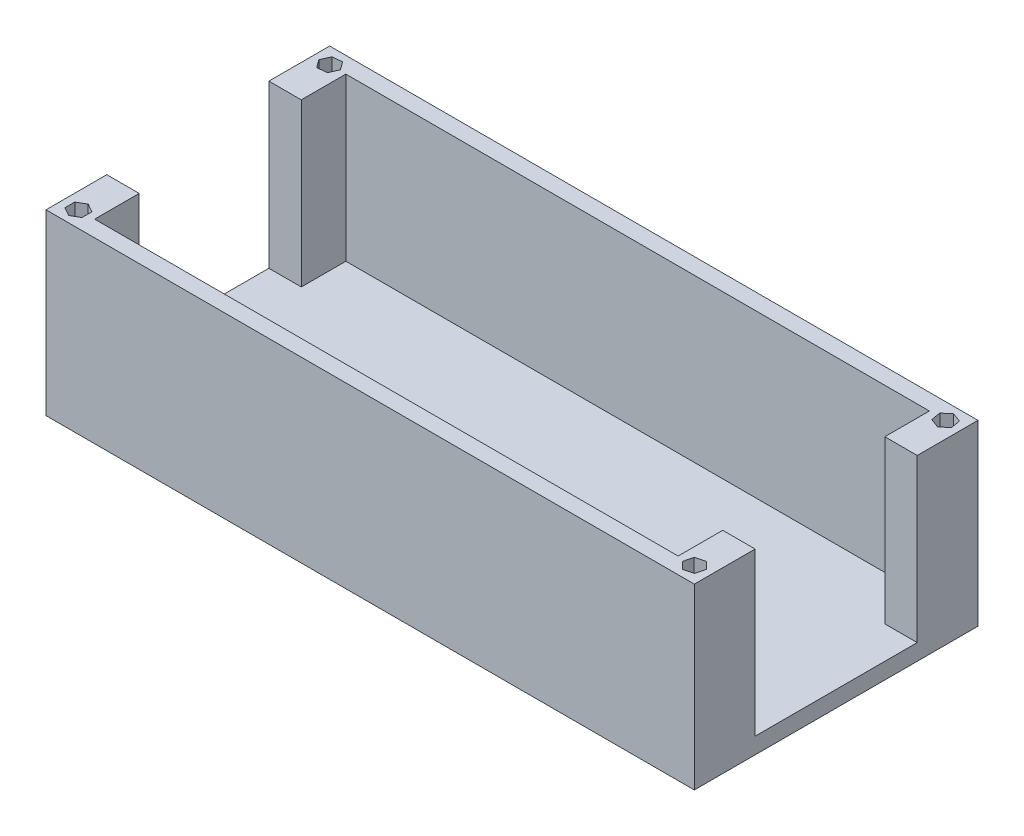
from build123d import *

# Parameters (mm, degrees)
SKETCH1_W           = 80
SKETCH1_H           = 35
BOSS_EXTRUDE1_DEPTH = 2
BOSS_EXTRUDE2_DEPTH = 20
CUT_EXTRUDE1_DEPTH  = 2.3


with BuildPart() as part:
    # Sketch1 → Boss-Extrude1 (new body)
    with BuildSketch(Plane(origin=(0, 0, 0), x_dir=(1, 0, 0), z_dir=(0, 1, 0))):
        with Locations((40, -17.5)):
            Rectangle(SKETCH1_W, SKETCH1_H)
    extrude(amount=BOSS_EXTRUDE1_DEPTH)

    # Sketch2 → Boss-Extrude2 (add)
    with BuildSketch(Plane(origin=(0, 2, 0), x_dir=(1, 0, 0), z_dir=(0, 1, 0))):
        Polygon((0, 0), (80, 0), (80, -7.5), (76, -7.5), (76, -2), (4, -2), (4, -7.5), (0, -7.5), align=None)
        Polygon((0, -35), (80, -35), (80, -27.5), (76, -27.5), (76, -33), (4, -33), (4, -27.5), (0, -27.5), align=None)
    extrude(amount=BOSS_EXTRUDE2_DEPTH)

    # Sketch3 → Cut-Extrude1 (cut)
    with BuildSketch(Plane(origin=(0, 22, 0), x_dir=(1, 0, 0), z_dir=(0, 1, 0))):
        Polygon((2.490559859, -0.891238969), (1.285064709, -1.020782184), (0.794504851, -2.129543216), (1.509440141, -3.108761031), (2.714935291, -2.979217816), (3.205495149, -1.870456784), align=None)
        Polygon((2, -31.787564435), (0.95, -32.393782217), (0.95, -33.606217783), (2, -34.212435565), (3.05, -33.606217783), (3.05, -32.393782217), align=None)
        Polygon((78.304035901, -31.826304055), (77.135567446, -32.149849214), (76.831531545, -33.323545158), (77.695964099, -34.173695945), (78.864432554, -33.850150786), (79.168468455, -32.676454842), align=None)
        Polygon((78.932445098, -1.225050879), (77.795096923, -0.805004297), (76.862651826, -1.579953418), (77.067554902, -2.774949121), (78.204903077, -3.194995703), (79.137348174, -2.420046582), align=None)
    extrude(amount=-CUT_EXTRUDE1_DEPTH, mode=Mode.SUBTRACT)


solid = part.part
